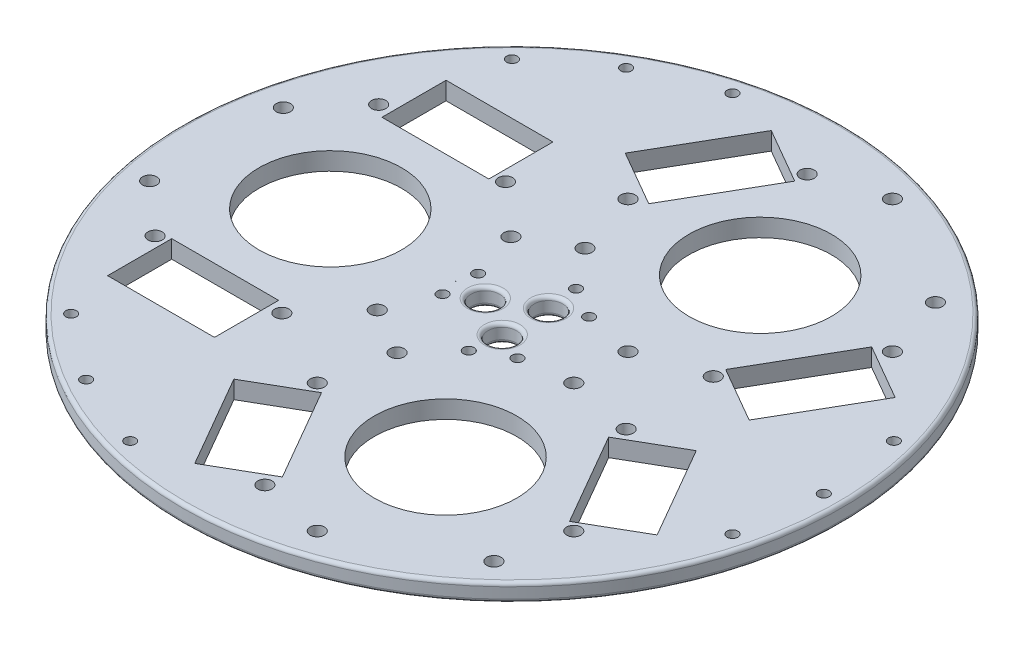
from build123d import *

# Parameters (mm, degrees)
SKETCH1_R           = 92.5
SKETCH1_R_2         = 2
SKETCH1_R_3         = 20
BOSS_EXTRUDE1_DEPTH = 5
SKETCH4_W           = 30
SKETCH4_H           = 18
CUT_EXTRUDE5_DEPTH  = 5
SKETCH8_R           = 1.5
CUT_EXTRUDE6_DEPTH  = 131.910274616
FILLET2_R           = 1
SKETCH10_R          = 4
CUT_EXTRUDE7_DEPTH  = 10
FILLET3_R           = 1
SKETCH12_R          = 1.5
CUT_EXTRUDE8_DEPTH  = 131.910274687


with BuildPart() as part:
    # Sketch1 → Boss-Extrude1 (new body)
    with BuildSketch(Plane(origin=(0, 0, 0), x_dir=(1, 0, 0), z_dir=(0, 1, 0))):
        with Locations(Location((0, 0, 0), (0, 0, 270))):
            Circle(SKETCH1_R)
        with BuildLine():
            Line((-18.689999934, -0.001566969), (-14.999999947, -0.001257599))
            ThreePointArc((-14.999999947, -0.001257599), (-14.999999852, -0.002766719), (-14.999999821, -0.004275838))
            Line((-14.999999821, -0.004275838), (-18.689999821, -0.004275838))
            ThreePointArc((-18.689999821, -0.004275838), (-18.689999849, -0.002921404), (-18.689999934, -0.001566969))
        make_face(mode=Mode.SUBTRACT)
        with Locations(Location((-18.861797086, 18.550724162, 0), (0, 0, 270))):
            Circle(SKETCH1_R_2, mode=Mode.SUBTRACT)
        with Locations(Location((-32.999999821, 31.172638698, 0), (0, 0, 270))):
            Circle(SKETCH1_R_2, mode=Mode.SUBTRACT)
        with Locations(Location((-69.554999821, 32.133926896, 0), (0, 0, 270))):
            Circle(SKETCH1_R_2, mode=Mode.SUBTRACT)
        with Locations(Location((-82.176914357, 17.995724162, 0), (0, 0, 270))):
            Circle(SKETCH1_R_2, mode=Mode.SUBTRACT)
        with Locations(Location((-83.138202555, -18.559275838, 0), (0, 0, 270))):
            Circle(SKETCH1_R_2, mode=Mode.SUBTRACT)
        with Locations(Location((-68.999999821, -31.181190374, 0), (0, 0, 270))):
            Circle(SKETCH1_R_2, mode=Mode.SUBTRACT)
        with Locations(Location((-32.444999821, -32.142478573, 0), (0, 0, 270))):
            Circle(SKETCH1_R_2, mode=Mode.SUBTRACT)
        with Locations(Location((-19.823085285, -18.004275838, 0), (0, 0, 270))):
            Circle(SKETCH1_R_2, mode=Mode.SUBTRACT)
        with Locations(Location((-50.999999821, -0.004275838, 0), (0, 0, 270))):
            Circle(SKETCH1_R_3, mode=Mode.SUBTRACT)
        with Locations(Location((25.503702895, -8.165157519, 0), (0, 0, 270))):
            Circle(SKETCH1_R_2, mode=Mode.SUBTRACT)
        with Locations(Location((56.673211462, 62.169433357, 0), (0, 0, 270))):
            Circle(SKETCH1_R_2, mode=Mode.SUBTRACT)
        with Locations(Location((44.058702895, -12.026954784, 0), (0, 0, 270))):
            Circle(SKETCH1_R_2, mode=Mode.SUBTRACT)
        with Locations(Location((62.606296926, 44.169433357, 0), (0, 0, 270))):
            Circle(SKETCH1_R_2, mode=Mode.SUBTRACT)
        with Locations(Location((25.496296926, 81.279433357, 0), (0, 0, 270))):
            Circle(SKETCH1_R_2, mode=Mode.SUBTRACT)
        with Locations(Location((-11.613703074, 44.169433357, 0), (0, 0, 270))):
            Circle(SKETCH1_R_2, mode=Mode.SUBTRACT)
        with Locations(Location((25.496296926, 7.059433357, 0), (0, 0, 270))):
            Circle(SKETCH1_R_2, mode=Mode.SUBTRACT)
        with Locations(Location((7.496296926, 75.346347893, 0), (0, 0, 270))):
            Circle(SKETCH1_R_2, mode=Mode.SUBTRACT)
        with Locations(Location((-5.68061761, 26.169433357, 0), (0, 0, 270))):
            Circle(SKETCH1_R_2, mode=Mode.SUBTRACT)
        with Locations(Location((25.496296926, 44.169433357, 0), (0, 0, 270))):
            Circle(SKETCH1_R_3, mode=Mode.SUBTRACT)
        with Locations(Location((43.496296926, 12.992518821, 0), (0, 0, 270))):
            Circle(SKETCH1_R_2, mode=Mode.SUBTRACT)
        with Locations(Location((6.948702895, -76.303360253, 0), (0, 0, 270))):
            Circle(SKETCH1_R_2, mode=Mode.SUBTRACT)
        with Locations(Location((25.503702895, -80.165157519, 0), (0, 0, 270))):
            Circle(SKETCH1_R_2, mode=Mode.SUBTRACT)
        with Locations(Location((-10.496297105, -44.165157519, 0), (0, 0, 270))):
            Circle(SKETCH1_R_2, mode=Mode.SUBTRACT)
        with Locations(Location((25.503702895, -44.165157519, 0), (0, 0, 270))):
            Circle(SKETCH1_R_3, mode=Mode.SUBTRACT)
        with Locations(Location((57.641905629, -62.720157519, 0), (0, 0, 270))):
            Circle(SKETCH1_R_2, mode=Mode.SUBTRACT)
        with Locations(Location((61.503702895, -44.165157519, 0), (0, 0, 270))):
            Circle(SKETCH1_R_2, mode=Mode.SUBTRACT)
        with Locations(Location((-6.63449984, -25.610157519, 0), (0, 0, 270))):
            Circle(SKETCH1_R_2, mode=Mode.SUBTRACT)
    extrude(amount=BOSS_EXTRUDE1_DEPTH)

    # Sketch4 → Cut-Extrude5 (cut)
    with BuildSketch(Plane(origin=(0, 5, 0), x_dir=(1, 0, 0), z_dir=(0, 1, 0))):
        with Locations((-50.999999821, 38.495724162)):
            Rectangle(SKETCH4_W, SKETCH4_H)
        with Locations((-50.999999821, -38.504275838)):
            Rectangle(SKETCH4_W, SKETCH4_H)
        Polygon((7.448547514, 71.909814414), (-8.139909754, 80.909814414), (-23.139909754, 54.9290523), (-7.551452486, 45.9290523), align=None)
        Polygon((74.132503606, 33.409814414), (58.544046338, 42.409814414), (43.544046338, 16.4290523), (59.132503606, 7.4290523), align=None)
        Polygon((58.551452306, -42.405538575), (74.139909575, -33.405538575), (59.139909575, -7.424776462), (43.551452306, -16.424776462), align=None)
        Polygon((-8.132503785, -80.905538575), (7.455953483, -71.905538575), (-7.544046517, -45.924776462), (-23.132503785, -54.924776462), align=None)
    extrude(amount=-CUT_EXTRUDE5_DEPTH, mode=Mode.SUBTRACT)

    # Sketch8 → Cut-Extrude6 (cut, through all)
    with BuildSketch(Plane(origin=(0, 5, 0), x_dir=(1, 0, 0), z_dir=(0, 1, 0))):
        with Locations(Location((-43.756353006, 75.773554566, 0), (0, 0, 270))):
            Circle(SKETCH8_R)
        with Locations(Location((-22.653752396, 84.516610808, 0), (0, 0, 270))):
            Circle(SKETCH8_R)
        with Locations(Location((-61.877030469, 61.866655803, 0), (0, 0, 270))):
            Circle(SKETCH8_R)
        with Locations(Location((87.499999692, 0.007335997, 0), (0, 0, 270))):
            Circle(SKETCH8_R)
        with Locations(Location((84.516610808, 22.653752396, 0), (0, 0, 270))):
            Circle(SKETCH8_R)
        with Locations(Location((84.520408199, -22.639580338, 0), (0, 0, 270))):
            Circle(SKETCH8_R)
        with Locations(Location((-43.743646687, -75.780890563, 0), (0, 0, 270))):
            Circle(SKETCH8_R)
        with Locations(Location((-22.639580338, -84.520408199, 0), (0, 0, 270))):
            Circle(SKETCH8_R)
        with Locations(Location((-61.866655803, -61.877030469, 0), (0, 0, 270))):
            Circle(SKETCH8_R)
    extrude(amount=-CUT_EXTRUDE6_DEPTH, mode=Mode.SUBTRACT)

    # Fillet2
    fillet2_edges = [part.edges().sort_by_distance(p)[0] for p in [
        (0, 5, -92.5),
        (0, 0, -92.5),
    ]]
    fillet(fillet2_edges, radius=FILLET2_R)

    # Sketch10 → Cut-Extrude7 (cut)
    with BuildSketch(Plane(origin=(0, 5, 0), x_dir=(1, 0, 0), z_dir=(0, 1, 0))):
        with Locations(Location((-7.5, 0, 0), (0, 0, 270))):
            Circle(SKETCH10_R)
        with Locations(Location((3.74945543, 6.495504905, 0), (0, 0, 270))):
            Circle(SKETCH10_R)
        with Locations(Location((3.749999974, -6.494561729, 0), (0, 0, 270))):
            Circle(SKETCH10_R)
    extrude(amount=-CUT_EXTRUDE7_DEPTH, mode=Mode.SUBTRACT)

    # Fillet3
    fillet3_edges = [part.edges().sort_by_distance(p)[0] for p in [
        (-7.5, 0, -4),
        (-7.5, 5, -4),
        (3.74945543, 0, -10.495504905),
        (3.74945543, 5, -10.495504905),
        (3.749999974, 0, 2.494561729),
        (3.749999974, 5, 2.494561729),
    ]]
    fillet(fillet3_edges, radius=FILLET3_R)

    # Sketch12 → Cut-Extrude8 (cut, through all)
    with BuildSketch(Plane.XZ):
        with Locations(Location((-14.499999821, -4.995724162, 0), (0, 0, 270))):
            Circle(SKETCH12_R)
        with Locations(Location((-14.499999821, 4.998155521, 0), (0, 0, 270))):
            Circle(SKETCH12_R)
        with Locations(Location((2.916169907, -15.059506119, 0), (0, 0, 270))):
            Circle(SKETCH12_R)
        with Locations(Location((11.576423945, -10.059506119, 0), (0, 0, 270))):
            Circle(SKETCH12_R)
        with Locations(Location((11.583829914, 10.055230281, 0), (0, 0, 270))):
            Circle(SKETCH12_R)
        with Locations(Location((2.923575876, 15.055230281, 0), (0, 0, 270))):
            Circle(SKETCH12_R)
    extrude(amount=-CUT_EXTRUDE8_DEPTH, mode=Mode.SUBTRACT)


solid = part.part
